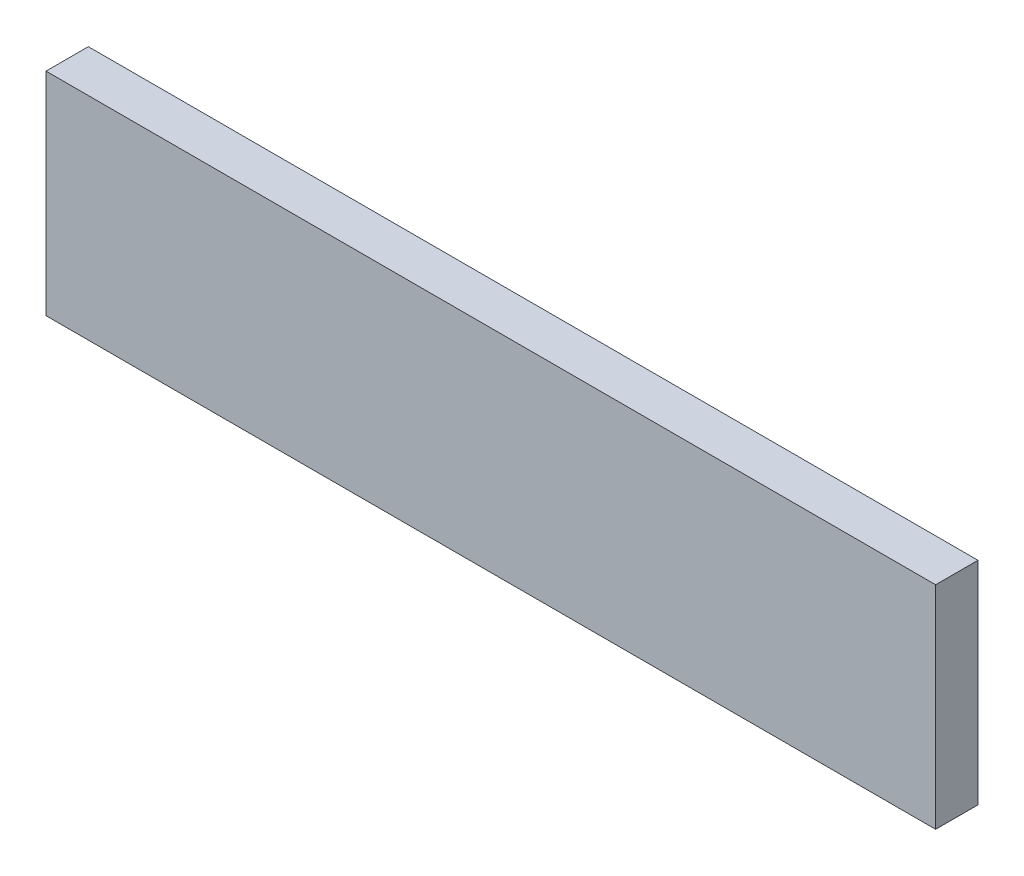
from build123d import *

# Parameters (mm, degrees)
SKETCH_1_W      = 420
SKETCH_1_H      = 20
EXTRUDE_1_DEPTH = 100


with BuildPart() as part:
    # 草图1 → 凸台-拉伸1 (new body)
    with BuildSketch(Plane(origin=(0, 0, 0), x_dir=(1, 0, 0), z_dir=(0, 1, 0))):
        with Locations((210, -10)):
            Rectangle(SKETCH_1_W, SKETCH_1_H)
    extrude(amount=EXTRUDE_1_DEPTH)


solid = part.part
